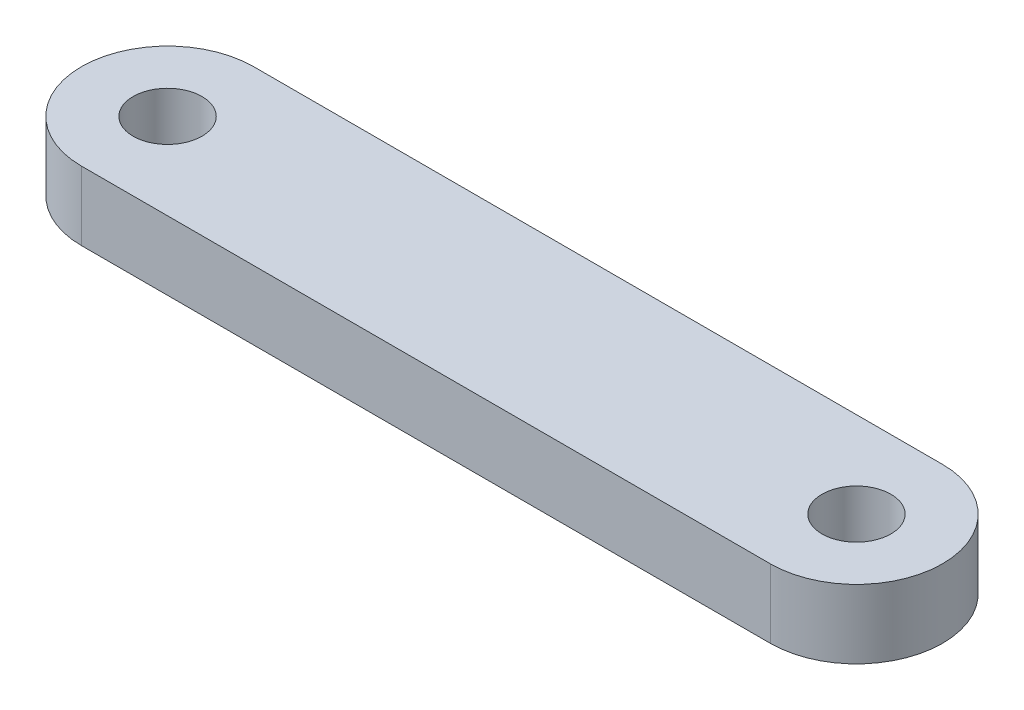
from build123d import *

# Parameters (mm, degrees)
SKETCH1_R           = 1
BOSS_EXTRUDE1_DEPTH = 2


with BuildPart() as part:
    # Sketch1 → Boss-Extrude1 (new body)
    with BuildSketch(Plane(origin=(0, 0, 0), x_dir=(1, 0, 0), z_dir=(0, 1, 0))):
        with BuildLine():
            Line((-10, 2.5), (10, 2.5))
            ThreePointArc((10, 2.5), (12.5, 0), (10, -2.5))
            Line((10, -2.5), (-10, -2.5))
            ThreePointArc((-10, -2.5), (-12.5, 0), (-10, 2.5))
        make_face()
        with Locations(Location((10, 0, 0), (0, 0, 270))):
            Circle(SKETCH1_R, mode=Mode.SUBTRACT)
        with Locations(Location((-10, 0, 0), (0, 0, 270))):
            Circle(SKETCH1_R, mode=Mode.SUBTRACT)
    extrude(amount=BOSS_EXTRUDE1_DEPTH)


solid = part.part
